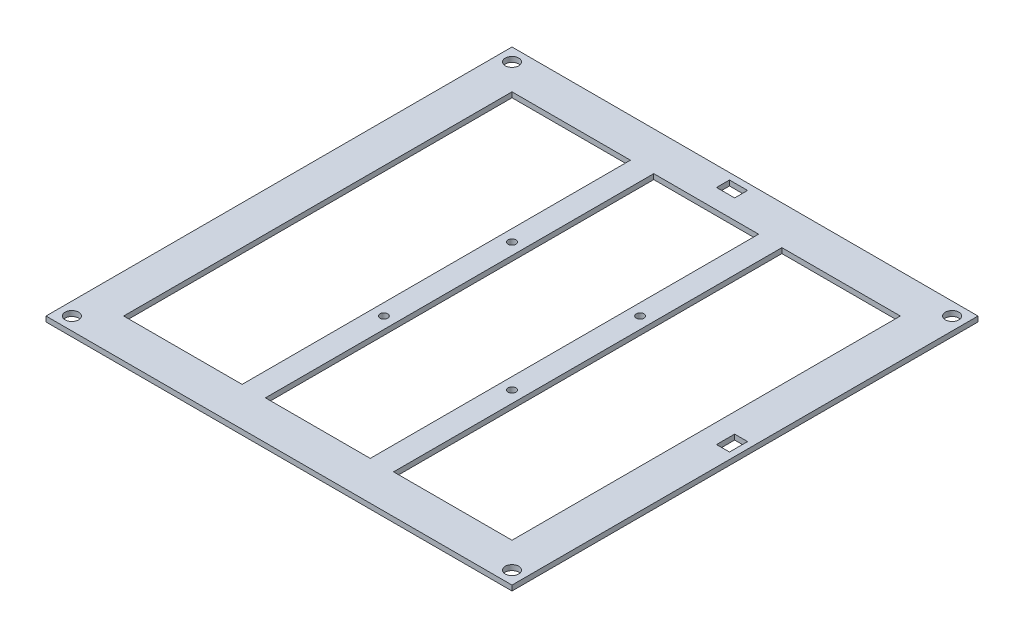
from build123d import *

# Parameters (mm, degrees)
CROQUIS1_W              = 190
CROQUIS1_H              = 190
CROQUIS1_R              = 1.5
CROQUIS1_R_2            = 2.6
CROQUIS1_W_2            = 45.75
CROQUIS1_H_2            = 150
CROQUIS1_W_3            = 40.5
CROQUIS1_W_4            = 5
CROQUIS1_H_3            = 7
CROQUIS1_W_5            = 7
CROQUIS1_H_4            = 5
SALIENTE_EXTRUIR1_DEPTH = 2
CROQUIS2_W              = 190
CROQUIS2_H              = 190
CROQUIS2_W_2            = 180
CROQUIS2_H_2            = 180
CORTAR_EXTRUIR1_DEPTH   = 74


with BuildPart() as part:
    # Croquis1 → Saliente-Extruir1 (new body)
    with BuildSketch(Plane(origin=(0, 0, 0), x_dir=(1, 0, 0), z_dir=(0, 1, 0))):
        with Locations((85, 85)):
            Rectangle(CROQUIS1_W, CROQUIS1_H)
        with Locations(Location((60.25, 109.75, 0), (0, 0, 270))):
            Circle(CROQUIS1_R, mode=Mode.SUBTRACT)
        with Locations(Location((60.25, 60.25, 0), (0, 0, 270))):
            Circle(CROQUIS1_R, mode=Mode.SUBTRACT)
        with Locations(Location((0, 170, 0), (0, 0, 270))):
            Circle(CROQUIS1_R_2, mode=Mode.SUBTRACT)
        with Locations(Location((0, 0, 0), (0, 0, 270))):
            Circle(CROQUIS1_R_2, mode=Mode.SUBTRACT)
        with Locations(Location((109.75, 109.75, 0), (0, 0, 90))):
            Circle(CROQUIS1_R, mode=Mode.SUBTRACT)
        with Locations(Location((109.75, 60.25, 0), (0, 0, 90))):
            Circle(CROQUIS1_R, mode=Mode.SUBTRACT)
        with Locations(Location((170, 0, 0), (0, 0, 90))):
            Circle(CROQUIS1_R_2, mode=Mode.SUBTRACT)
        with Locations(Location((170, 170, 0), (0, 0, 90))):
            Circle(CROQUIS1_R_2, mode=Mode.SUBTRACT)
        with Locations((32.875, 85)):
            Rectangle(CROQUIS1_W_2, CROQUIS1_H_2, mode=Mode.SUBTRACT)
        with Locations((137.125, 85)):
            Rectangle(CROQUIS1_W_2, CROQUIS1_H_2, mode=Mode.SUBTRACT)
        with Locations((85, 85)):
            Rectangle(CROQUIS1_W_3, CROQUIS1_H_2, mode=Mode.SUBTRACT)
        with Locations((170, 85)):
            Rectangle(CROQUIS1_W_4, CROQUIS1_H_3, mode=Mode.SUBTRACT)
        with Locations((85, 170)):
            Rectangle(CROQUIS1_W_5, CROQUIS1_H_4, mode=Mode.SUBTRACT)
    extrude(amount=SALIENTE_EXTRUIR1_DEPTH)

    # Croquis2 → Cortar-Extruir1 (cut)
    with BuildSketch(Plane(origin=(0, 2, 0), x_dir=(1, 0, 0), z_dir=(0, 1, 0))):
        with Locations((85, 85)):
            Rectangle(CROQUIS2_W, CROQUIS2_H)
        with Locations((85, 85)):
            Rectangle(CROQUIS2_W_2, CROQUIS2_H_2, mode=Mode.SUBTRACT)
    extrude(amount=-CORTAR_EXTRUIR1_DEPTH, mode=Mode.SUBTRACT)


solid = part.part
